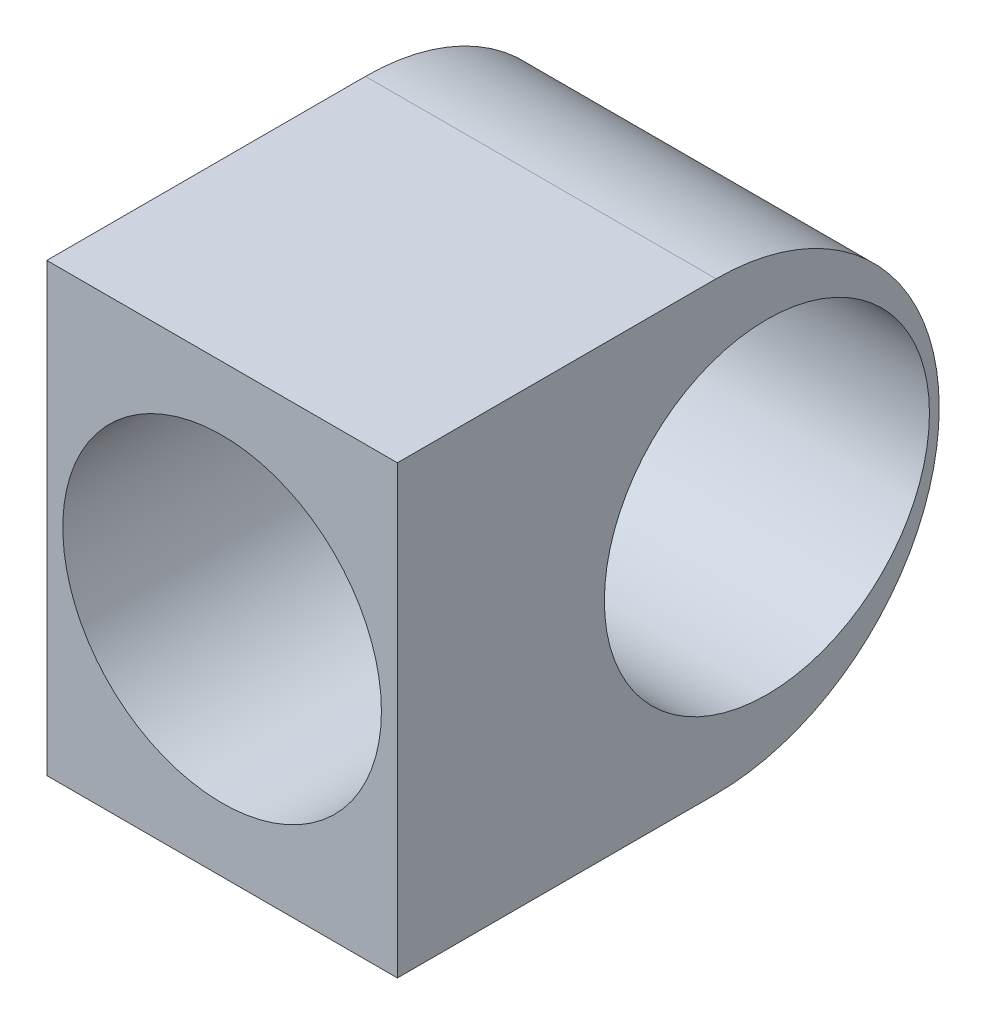
from build123d import *

# Parameters (mm, degrees)
SKETCH1_W           = 5.5
SKETCH1_H           = 7
BOSS_EXTRUDE1_DEPTH = 5
BOSS_EXTRUDE2_DEPTH = 5.5
SKETCH4_R           = 2.55
CUT_EXTRUDE1_DEPTH  = 11.210288928
SKETCH5_R           = 2.499369643
CUT_EXTRUDE2_DEPTH  = 4


with BuildPart() as part:
    # Sketch1 → Boss-Extrude1 (new body)
    with BuildSketch(Plane.XY):
        with Locations((2.75, 3.5)):
            Rectangle(SKETCH1_W, SKETCH1_H)
    extrude(amount=BOSS_EXTRUDE1_DEPTH)

    # Sketch3 → Boss-Extrude2 (add)
    with BuildSketch(Plane(origin=(5.5, 0, 0), x_dir=(0, 0, -1), z_dir=(1, 0, 0))):
        with BuildLine():
            Line((0, 7), (0, 0))
            ThreePointArc((0, 0), (3.5, 3.5), (0, 7))
        make_face()
    extrude(amount=-BOSS_EXTRUDE2_DEPTH)

    # Sketch4 → Cut-Extrude1 (cut, through all)
    with BuildSketch(Plane.ZY):
        with Locations((-0.797128345, 3.5)):
            Circle(SKETCH4_R)
    extrude(amount=-CUT_EXTRUDE1_DEPTH, mode=Mode.SUBTRACT)

    # Sketch5 → Cut-Extrude2 (cut)
    with BuildSketch(Plane.XY.offset(5)):
        with Locations((2.75, 3.5)):
            Circle(SKETCH5_R)
    extrude(amount=-CUT_EXTRUDE2_DEPTH, mode=Mode.SUBTRACT)


solid = part.part
